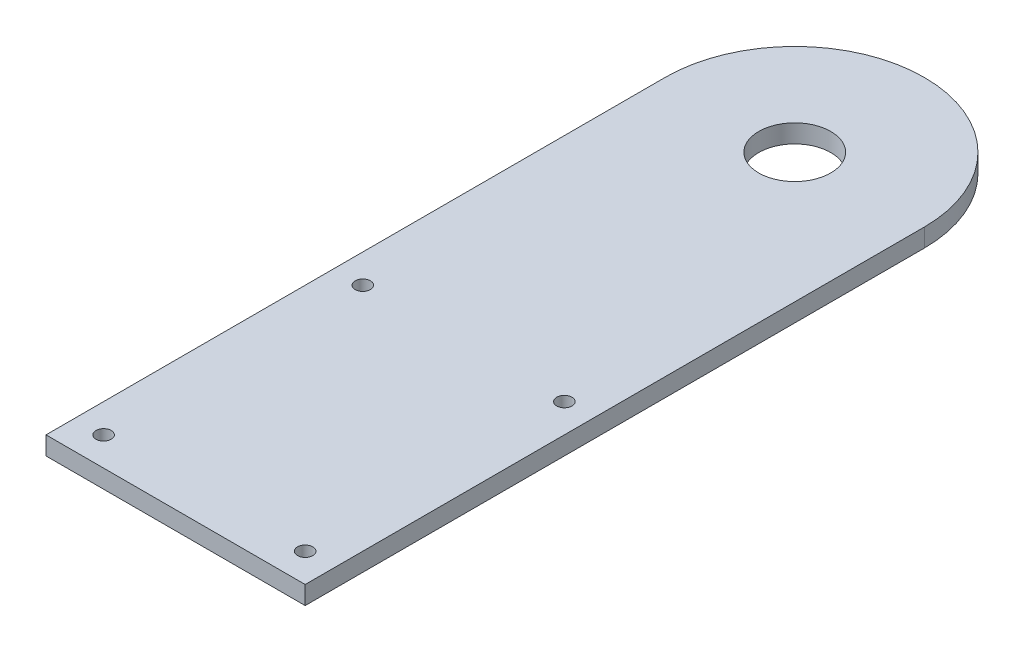
from build123d import *

# Parameters (mm, degrees)
SKETCH1_R            = 12.5
BOSS_EXTRUDE1_DEPTH  = 6.35
M5_CLEARANCE_HOLE1_D = 5.3


with BuildPart() as part:
    # Sketch1 → Boss-Extrude1 (new body)
    with BuildSketch(Plane(origin=(0, 0, 0), x_dir=(1, 0, 0), z_dir=(0, 1, 0))):
        with BuildLine():
            Line((-45, -107.5), (-45, 107.5))
            ThreePointArc((-45, 107.5), (0, 152.5), (45, 107.5))
            Line((45, 107.5), (45, -107.5))
            Line((45, -107.5), (-45, -107.5))
        make_face()
        with Locations(Location((0, 107.5, 0), (0, 0, 270))):
            Circle(SKETCH1_R, mode=Mode.SUBTRACT)
    extrude(amount=-BOSS_EXTRUDE1_DEPTH)

    # M5 Clearance Hole1 (through all)
    with Locations(Plane(origin=(-35, 0, 7.5), x_dir=(0, 0, 1), z_dir=(0, 1, 0))):
        with Locations((0, 0), (0, 70), (90, 0), (90, 70)):
            Hole(M5_CLEARANCE_HOLE1_D / 2)


solid = part.part
